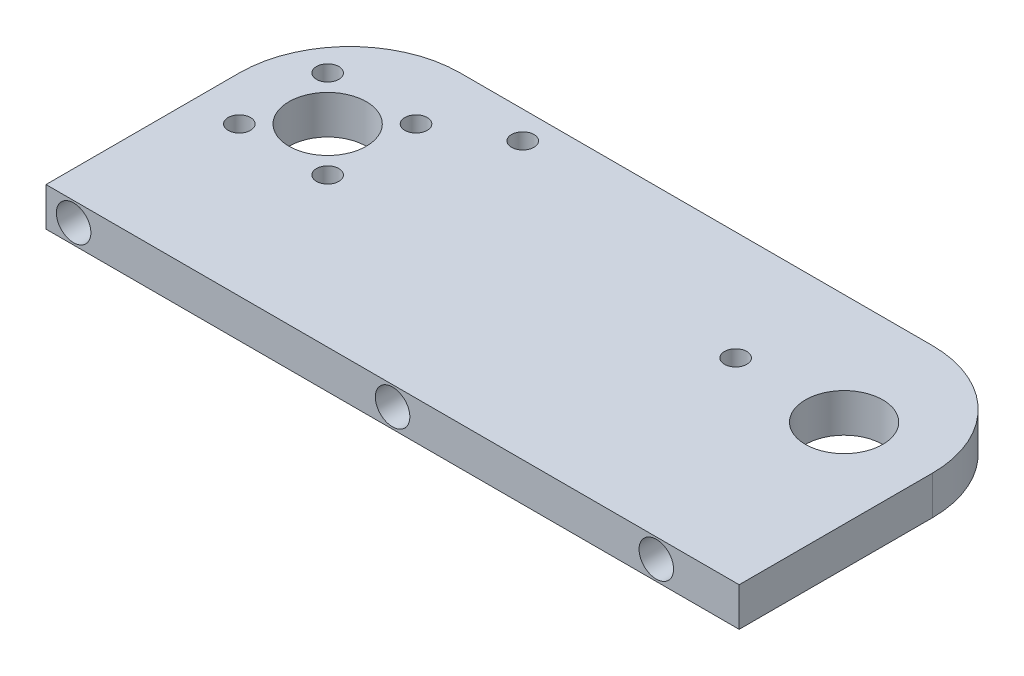
from build123d import *

# Parameters (mm, degrees)
SKETCH2_W           = 125.512132551
SKETCH2_H           = 55
SKETCH2_R           = 7
BOSS_EXTRUDE1_DEPTH = 7
FILLET4_R           = 20
SKETCH5_R           = 2.025
CUT_EXTRUDE1_DEPTH  = 10
SKETCH6_R           = 2.025
CUT_EXTRUDE2_DEPTH  = 33
SKETCH7_R           = 3.125
CUT_EXTRUDE3_DEPTH  = 4.7
SKETCH8_R           = 2.025
CUT_EXTRUDE4_DEPTH  = 7


with BuildPart() as part:
    # Sketch2 → Boss-Extrude1 (new body)
    with BuildSketch(Plane(origin=(0, 0, 0), x_dir=(1, 0, 0), z_dir=(0, 1, 0))):
        with Locations((82.945127875, 24.3964427)):
            Rectangle(SKETCH2_W, SKETCH2_H)
        with Locations(Location((36.189061599, 31.8964427, 0), (0, 0, 270))):
            Circle(SKETCH2_R, mode=Mode.SUBTRACT)
        with Locations(Location((129.70119415, 31.8964427, 0), (0, 0, 270))):
            Circle(SKETCH2_R, mode=Mode.SUBTRACT)
    extrude(amount=BOSS_EXTRUDE1_DEPTH)

    # Fillet4
    fillet4_edges = [part.edges().sort_by_distance(p)[0] for p in [
        (145.70119415, 3.5, -51.8964427),
        (20.189061599, 3.5, -51.8964427),
    ]]
    fillet(fillet4_edges, radius=FILLET4_R)

    # Sketch5 → Cut-Extrude1 (cut)
    with BuildSketch(Plane(origin=(0, 7, 0), x_dir=(1, 0, 0), z_dir=(0, 1, 0))):
        with Locations(Location((109.81119415, 32.1464427, 0), (0, 0, 270))):
            Circle(SKETCH5_R)
    extrude(amount=-CUT_EXTRUDE1_DEPTH, mode=Mode.SUBTRACT)

    # Sketch6 → Cut-Extrude2 (cut)
    with BuildSketch(Plane(origin=(0, 7, 0), x_dir=(1, 0, 0), z_dir=(0, 1, 0))):
        with Locations(Location((28.189061599, 39.8964427, 0), (0, 0, 270))):
            Circle(SKETCH6_R)
        with Locations(Location((44.189061599, 39.8964427, 0), (0, 0, 270))):
            Circle(SKETCH6_R)
        with Locations(Location((44.189061599, 23.8964427, 0), (0, 0, 270))):
            Circle(SKETCH6_R)
        with Locations(Location((28.189061599, 23.8964427, 0), (0, 0, 270))):
            Circle(SKETCH6_R)
    extrude(amount=-CUT_EXTRUDE2_DEPTH, mode=Mode.SUBTRACT)

    # Sketch7 → Cut-Extrude3 (cut)
    with BuildSketch(Plane.XY.offset(3.1035573)):
        with Locations((25.189061599, 3.5)):
            Circle(SKETCH7_R)
        with Locations((130.70119415, 3.5)):
            Circle(SKETCH7_R)
        with Locations((82.945127875, 3.5)):
            Circle(SKETCH7_R)
    extrude(amount=-CUT_EXTRUDE3_DEPTH, mode=Mode.SUBTRACT)

    # Sketch8 → Cut-Extrude4 (cut)
    with BuildSketch(Plane(origin=(0, 7, 0), x_dir=(1, 0, 0), z_dir=(0, 1, 0))):
        with Locations(Location((56.514656449, 46.8964427, 0), (0, 0, 270))):
            Circle(SKETCH8_R)
    extrude(amount=-CUT_EXTRUDE4_DEPTH, mode=Mode.SUBTRACT)


solid = part.part
